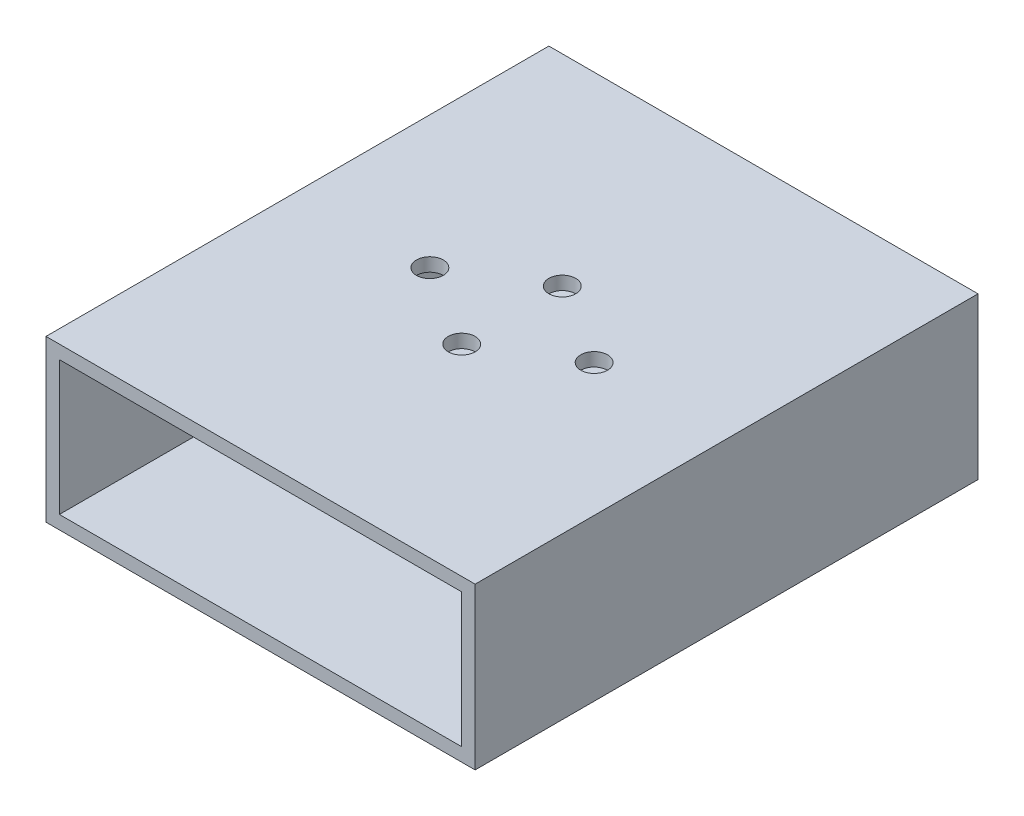
from build123d import *

# Parameters (mm, degrees)
IZIM1_W               = 128
IZIM1_H               = 48
IZIM1_W_2             = 120
IZIM1_H_2             = 40
EKSTR_ZYON_NCE1_DEPTH = 150
KES_EKSTR_ZYON1_REACH = 202.449
IZIM2_R               = 4


with BuildPart() as part:
    # Çizim1 → Ekstrüzyon-İnce1 (new body)
    with BuildSketch(Plane.XY):
        with Locations((-60, 20)):
            Rectangle(IZIM1_W, IZIM1_H)
        with Locations((-60, 20)):
            Rectangle(IZIM1_W_2, IZIM1_H_2, mode=Mode.SUBTRACT)
    extrude(amount=EKSTR_ZYON_NCE1_DEPTH)

    # Çizim2 → Kes-Ekstrüzyon1 (cut, up to next)
    with BuildSketch(Plane(origin=(0, 44, 0), x_dir=(1, 0, 0), z_dir=(0, 1, 0)), mode=Mode.PRIVATE) as kes_ekstr_zyon1_sk1:
        with Locations(Location((-84.5, -75, 0), (0, 0, 180))):
            Circle(IZIM2_R)
    kes_ekstr_zyon1_tool1 = extrude(kes_ekstr_zyon1_sk1.sketch, amount=-KES_EKSTR_ZYON1_REACH, mode=Mode.PRIVATE) & part.part
    # Çizim2 → Kes-Ekstrüzyon1 (cut, up to next)
    with BuildSketch(Plane(origin=(0, 44, 0), x_dir=(1, 0, 0), z_dir=(0, 1, 0)), mode=Mode.PRIVATE) as kes_ekstr_zyon1_sk2:
        with Locations((-35.5, -75)):
            Circle(IZIM2_R)
    kes_ekstr_zyon1_tool2 = extrude(kes_ekstr_zyon1_sk2.sketch, amount=-KES_EKSTR_ZYON1_REACH, mode=Mode.PRIVATE) & part.part
    # Çizim2 → Kes-Ekstrüzyon1 (cut, up to next)
    with BuildSketch(Plane(origin=(0, 44, 0), x_dir=(1, 0, 0), z_dir=(0, 1, 0)), mode=Mode.PRIVATE) as kes_ekstr_zyon1_sk3:
        with Locations(Location((-60, -60, 0), (0, 0, 180))):
            Circle(IZIM2_R)
    kes_ekstr_zyon1_tool3 = extrude(kes_ekstr_zyon1_sk3.sketch, amount=-KES_EKSTR_ZYON1_REACH, mode=Mode.PRIVATE) & part.part
    # Çizim2 → Kes-Ekstrüzyon1 (cut, up to next)
    with BuildSketch(Plane(origin=(0, 44, 0), x_dir=(1, 0, 0), z_dir=(0, 1, 0)), mode=Mode.PRIVATE) as kes_ekstr_zyon1_sk4:
        with Locations((-60, -90)):
            Circle(IZIM2_R)
    kes_ekstr_zyon1_tool4 = extrude(kes_ekstr_zyon1_sk4.sketch, amount=-KES_EKSTR_ZYON1_REACH, mode=Mode.PRIVATE) & part.part
    add(kes_ekstr_zyon1_tool1.solids().sort_by_distance((-84.5, 44, 75))[0], mode=Mode.SUBTRACT)
    add(kes_ekstr_zyon1_tool2.solids().sort_by_distance((-35.5, 44, 75))[0], mode=Mode.SUBTRACT)
    add(kes_ekstr_zyon1_tool3.solids().sort_by_distance((-60, 44, 60))[0], mode=Mode.SUBTRACT)
    add(kes_ekstr_zyon1_tool4.solids().sort_by_distance((-60, 44, 90))[0], mode=Mode.SUBTRACT)


solid = part.part
